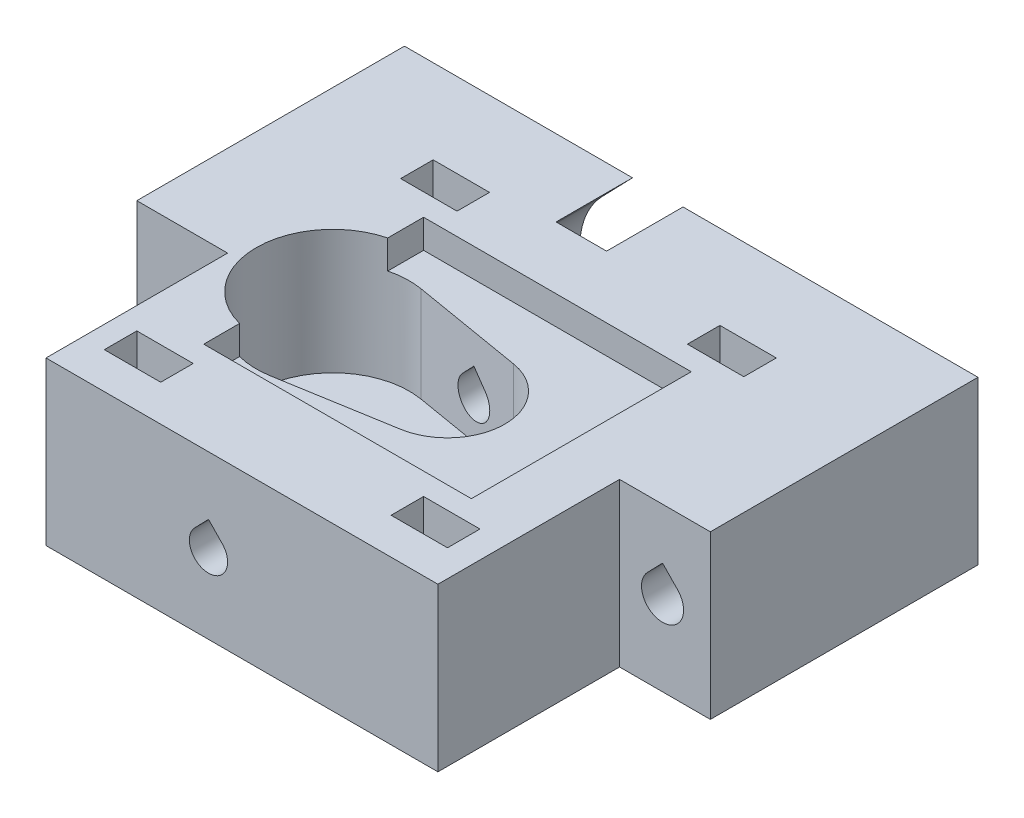
from build123d import *

# Parameters (mm, degrees)
SKETCH1_W           = 17
SKETCH1_H           = 47
BOSS_EXTRUDE1_DEPTH = 6.581097747
CUT_EXTRUDE1_DEPTH  = 8
BOSS_EXTRUDE2_START = 8
BOSS_EXTRUDE2_DEPTH = 8
SKETCH4_W           = 39
SKETCH4_H           = 17
BOSS_EXTRUDE3_DEPTH = 35.070363466
SKETCH5_W           = 47
SKETCH5_H           = 17
BOSS_EXTRUDE4_DEPTH = 18.348538787
BOSS_EXTRUDE5_START = 8
BOSS_EXTRUDE5_DEPTH = 8
CUT_EXTRUDE2_DEPTH  = 3
CUT_EXTRUDE3_DEPTH  = 10
SKETCH9_W           = 9.5
SKETCH9_H           = 19
CUT_EXTRUDE4_DEPTH  = 45.598206242
SKETCH10_W          = 9.5
SKETCH10_H          = 19
CUT_EXTRUDE5_DEPTH  = 45.598206242
SKETCH11_W          = 5.9
SKETCH11_H          = 3.4
CUT_EXTRUDE6_DEPTH  = 45.598206242
SKETCH12_W          = 5.9
SKETCH12_H          = 3.4
CUT_EXTRUDE7_DEPTH  = 45.598206242
SKETCH13_W          = 5.9
SKETCH13_H          = 3.4
CUT_EXTRUDE8_DEPTH  = 45.598206242
CUT_EXTRUDE9_REACH  = 61.346
CUT_EXTRUDE10_DEPTH = 46.793012567
CUT_EXTRUDE11_DEPTH = 46.793012567
SKETCH17_W          = 5.9
SKETCH17_H          = 3.4
CUT_EXTRUDE12_DEPTH = 45.598206242
CUT_EXTRUDE13_REACH = 55.235
SKETCH19_W          = 6
SKETCH19_H          = 14
HOLE1_D             = 4.2
HOLE1_DEPTH         = 17.000025


with BuildPart() as part:
    # Sketch1 → Boss-Extrude1 (new body)
    with BuildSketch(Plane(origin=(-9.651461213, 0, 0), x_dir=(0, -1, 0), z_dir=(-1, 0, 0))):
        with Locations((8.5, -2.5)):
            Rectangle(SKETCH1_W, SKETCH1_H)
    extrude(amount=-BOSS_EXTRUDE1_DEPTH)

    # Sketch2 → Cut-Extrude1 (cut)
    with BuildSketch(Plane(origin=(0, 0, -26), x_dir=(-1, 0, 0), z_dir=(0, 0, -1))):
        with BuildLine():
            Line((3.070363466, 0), (3.070363466, -17))
            Line((3.070363466, -17), (9.651461213, -17))
            Line((9.651461213, -17), (9.651461213, -8.859566716))
            ThreePointArc((9.651461213, -8.859566716), (9.032439772, -5.88096289), (7.364540596, -3.336678977))
            Line((7.364540596, -3.336678977), (4.142347163, 0))
            Line((4.142347163, 0), (3.070363466, 0))
        make_face()
    extrude(amount=-CUT_EXTRUDE1_DEPTH, mode=Mode.SUBTRACT)

    # Sketch3 → Boss-Extrude2 (add)
    with BuildSketch(Plane(origin=(0, 0, -18), x_dir=(-1, 0, 0), z_dir=(0, 0, -1)).offset(BOSS_EXTRUDE2_START)):
        with BuildLine():
            Line((9.651461213, -9.140433284), (9.651461213, -17))
            Line((9.651461213, -17), (3.070363466, -17))
            ThreePointArc((3.070363466, -17), (7.750733238, -14.233963642), (9.651461213, -9.140433284))
        make_face()
    extrude(amount=-BOSS_EXTRUDE2_DEPTH)

    # Sketch4 → Boss-Extrude3 (add)
    with BuildSketch(Plane(origin=(-3.070363466, 0, 0), x_dir=(0, 0, -1), z_dir=(1, 0, 0))):
        with Locations((-1.5, -8.5)):
            Rectangle(SKETCH4_W, SKETCH4_H)
    extrude(amount=BOSS_EXTRUDE3_DEPTH)

    # Sketch5 → Boss-Extrude4 (add)
    with BuildSketch(Plane.ZY.offset(9.651461213)):
        with Locations((-2.5, -8.5)):
            Rectangle(SKETCH5_W, SKETCH5_H)
    extrude(amount=BOSS_EXTRUDE4_DEPTH)

    # Sketch6 → Boss-Extrude5 (add)
    with BuildSketch(Plane(origin=(0, 0, -18), x_dir=(-1, 0, 0), z_dir=(0, 0, -1)).offset(BOSS_EXTRUDE5_START)):
        with BuildLine():
            Line((-32, -17), (-32, 0))
            Line((-32, 0), (-1.142347163, 0))
            Line((-1.142347163, 0), (-4.364540596, -3.336678977))
            ThreePointArc((-4.364540596, -3.336678977), (-6.277598276, -11.444382635), (-0.070363466, -17))
            Line((-0.070363466, -17), (-32, -17))
        make_face()
    extrude(amount=-BOSS_EXTRUDE5_DEPTH)

    # Sketch7 → Cut-Extrude2 (cut)
    with BuildSketch(Plane(origin=(0, 0, 0), x_dir=(-1, 0, 0), z_dir=(0, 1, 0))):
        with BuildLine():
            Line((11.5, -11.5), (11.5, -7.745966692))
            ThreePointArc((11.5, -7.745966692), (17.5, 0), (11.5, 7.745966692))
            Line((11.5, 7.745966692), (11.5, 11.5))
            Line((11.5, 11.5), (-16.5, 11.5))
            Line((-16.5, 11.5), (-16.5, -11.5))
            Line((-16.5, -11.5), (11.5, -11.5))
        make_face()
    extrude(amount=-CUT_EXTRUDE2_DEPTH, mode=Mode.SUBTRACT)

    # Sketch8 → Cut-Extrude3 (cut)
    with BuildSketch(Plane(origin=(0, -3, 0), x_dir=(-1, 0, 0), z_dir=(0, 1, 0))):
        with BuildLine():
            Line((-3.5, -5.916079783), (8.166666667, -7.888106377))
            ThreePointArc((8.166666667, -7.888106377), (17.5, 0), (8.166666667, 7.888106377))
            Line((8.166666667, 7.888106377), (-3.5, 5.916079783))
            ThreePointArc((-3.5, 5.916079783), (3.5, 0), (-3.5, -5.916079783))
        make_face()
    extrude(amount=-CUT_EXTRUDE3_DEPTH, mode=Mode.SUBTRACT)

    # Sketch9 → Cut-Extrude4 (cut, through all)
    with BuildSketch(Plane.XZ.offset(17)):
        with Locations((27.25, 11.5)):
            Rectangle(SKETCH9_W, SKETCH9_H)
    extrude(amount=-CUT_EXTRUDE4_DEPTH, mode=Mode.SUBTRACT)

    # Sketch10 → Cut-Extrude5 (cut, through all)
    with BuildSketch(Plane.XZ.offset(17)):
        with Locations((-23.25, 11.5)):
            Rectangle(SKETCH10_W, SKETCH10_H)
    extrude(amount=-CUT_EXTRUDE5_DEPTH, mode=Mode.SUBTRACT)

    # Sketch11 → Cut-Extrude6 (cut, through all)
    with BuildSketch(Plane.XZ.offset(17)):
        with Locations((-13.25, 15.5)):
            Rectangle(SKETCH11_W, SKETCH11_H)
    extrude(amount=-CUT_EXTRUDE6_DEPTH, mode=Mode.SUBTRACT)

    # Sketch12 → Cut-Extrude7 (cut, through all)
    with BuildSketch(Plane.XZ.offset(17)):
        with Locations((16.75, 15.5)):
            Rectangle(SKETCH12_W, SKETCH12_H)
    extrude(amount=-CUT_EXTRUDE7_DEPTH, mode=Mode.SUBTRACT)

    # Sketch13 → Cut-Extrude8 (cut, through all)
    with BuildSketch(Plane.XZ.offset(17)):
        with Locations((16.75, -15.5)):
            Rectangle(SKETCH13_W, SKETCH13_H)
    extrude(amount=-CUT_EXTRUDE8_DEPTH, mode=Mode.SUBTRACT)

    # Cut-Extrude9: up to this plane
    cut_extrude9_end = Plane(origin=(-8.166666667, -13, 7.888106377), z_dir=(0.16666666666666724, 0, 0.9860132971832694))
    # Sketch14 → Cut-Extrude9 (cut, up to the surface)
    with BuildSketch(Plane.XY.offset(21), mode=Mode.PRIVATE) as cut_extrude9_sk1:
        with BuildLine():
            Line((-0.061320399, -7.610683259), (-1.5, -6.120886921))
            Line((-1.5, -6.120886921), (-2.938679601, -7.610683259))
            ThreePointArc((-2.938679601, -7.610683259), (-1.5, -11), (-0.061320399, -7.610683259))
        make_face()
    cut_extrude9_tool1 = split(extrude(cut_extrude9_sk1.sketch, amount=-CUT_EXTRUDE9_REACH, mode=Mode.PRIVATE), bisect_by=cut_extrude9_end, keep=Keep.BOTH, mode=Mode.PRIVATE)
    add(cut_extrude9_tool1.solids().sort_by_distance((-1.5, -8.847599, 21))[0], mode=Mode.SUBTRACT)

    # Sketch15 → Cut-Extrude10 (cut, through all)
    with BuildSketch(Plane.XY.offset(2)):
        with BuildLine():
            Line((-21.417452439, -6.971751585), (-23, -5.332975613))
            Line((-23, -5.332975613), (-24.582547561, -6.971751585))
            ThreePointArc((-24.582547561, -6.971751585), (-23, -10.7), (-21.417452439, -6.971751585))
        make_face()
    extrude(amount=-CUT_EXTRUDE10_DEPTH, mode=Mode.SUBTRACT)

    # Sketch16 → Cut-Extrude11 (cut, through all)
    with BuildSketch(Plane.XY.offset(2)):
        with BuildLine():
            Line((28.582547561, -6.971751585), (27, -5.332975613))
            Line((27, -5.332975613), (25.417452439, -6.971751585))
            ThreePointArc((25.417452439, -6.971751585), (27, -10.7), (28.582547561, -6.971751585))
        make_face()
    extrude(amount=-CUT_EXTRUDE11_DEPTH, mode=Mode.SUBTRACT)

    # Sketch17 → Cut-Extrude12 (cut, through all)
    with BuildSketch(Plane.XZ.offset(17)):
        with Locations((-13.25, -15.5)):
            Rectangle(SKETCH17_W, SKETCH17_H)
    extrude(amount=-CUT_EXTRUDE12_DEPTH, mode=Mode.SUBTRACT)

    # Cut-Extrude13: up to this plane
    cut_extrude13_end = Plane(origin=(3.5, -13, -5.916079783), z_dir=(0.1666666666666663, 0, -0.9860132971832695))
    # Sketch18 → Cut-Extrude13 (cut, up to the surface)
    with BuildSketch(Plane(origin=(0, 0, -18), x_dir=(-1, 0, 0), z_dir=(0, 0, -1)), mode=Mode.PRIVATE) as cut_extrude13_sk1:
        with BuildLine():
            Line((1.5, -6.120886921), (0.061320399, -7.610683259))
            ThreePointArc((0.061320399, -7.610683259), (1.5, -11), (2.938679601, -7.610683259))
            Line((2.938679601, -7.610683259), (1.5, -6.120886921))
        make_face()
    cut_extrude13_tool1 = split(extrude(cut_extrude13_sk1.sketch, amount=-CUT_EXTRUDE13_REACH, mode=Mode.PRIVATE), bisect_by=cut_extrude13_end, keep=Keep.BOTH, mode=Mode.PRIVATE)
    add(cut_extrude13_tool1.solids().sort_by_distance((-1.5, -8.847599, -18))[0], mode=Mode.SUBTRACT)

    # Sketch19 → Cut-Revolve1 (revolve, cut)
    with BuildSketch(Plane.XY, mode=Mode.PRIVATE) as cut_revolve1_sk:
        with Locations((5.5, -10)):
            Rectangle(SKETCH19_W, SKETCH19_H)
    revolve(cut_revolve1_sk.sketch.rotate(Axis((2.5, -3, 0), (0, -1, 0)), 270), axis=Axis((2.5, -3, 0), (0, -1, 0)), mode=Mode.SUBTRACT)

    # Hole1
    with Locations(Plane.XZ.offset(17)):
        with Locations((-9.5, 0)):
            Hole(HOLE1_D / 2, depth=HOLE1_DEPTH)


solid = part.part
